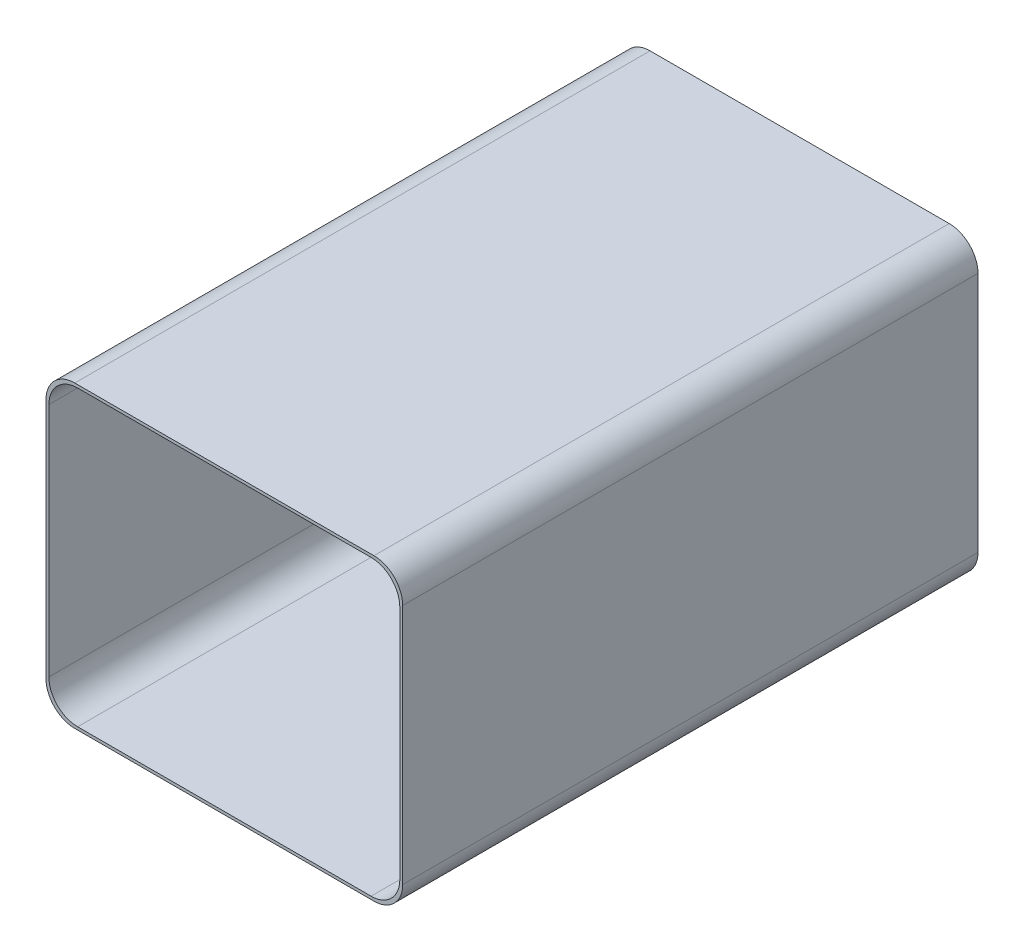
from build123d import *

# Parameters (mm, degrees)
EXTRUDE_2_DEPTH = 1000


with BuildPart() as part:
    # 草图1 → 凸台-拉伸2 (new body)
    with BuildSketch(Plane.XY):
        with BuildLine():
            Line((20.837944664, 75.234519104), (540.837944664, 75.234519104))
            ThreePointArc((540.837944664, 75.234519104), (576.193283723, 60.589858163), (590.837944664, 25.234519104))
            Line((590.837944664, 25.234519104), (590.837944664, -394.765480896))
            ThreePointArc((590.837944664, -394.765480896), (576.193283723, -430.120819955), (540.837944664, -444.765480896))
            Line((540.837944664, -444.765480896), (20.837944664, -444.765480896))
            ThreePointArc((20.837944664, -444.765480896), (-14.517394395, -430.120819955), (-29.162055336, -394.765480896))
            Line((-29.162055336, -394.765480896), (-29.162055336, 25.234519104))
            ThreePointArc((-29.162055336, 25.234519104), (-14.517394395, 60.589858163), (20.837944664, 75.234519104))
        make_face()
        with BuildLine():
            Line((25.837944664, 70.234519104), (535.837944664, 70.234519104))
            ThreePointArc((535.837944664, 70.234519104), (571.193283723, 55.589858163), (585.837944664, 20.234519104))
            Line((585.837944664, 20.234519104), (585.837944664, -389.765480896))
            ThreePointArc((585.837944664, -389.765480896), (571.193283723, -425.120819955), (535.837944664, -439.765480896))
            Line((535.837944664, -439.765480896), (25.837944664, -439.765480896))
            ThreePointArc((25.837944664, -439.765480896), (-9.517394395, -425.120819955), (-24.162055336, -389.765480896))
            Line((-24.162055336, -389.765480896), (-24.162055336, 20.234519104))
            ThreePointArc((-24.162055336, 20.234519104), (-9.517394395, 55.589858163), (25.837944664, 70.234519104))
        make_face(mode=Mode.SUBTRACT)
    extrude(amount=EXTRUDE_2_DEPTH)


solid = part.part
